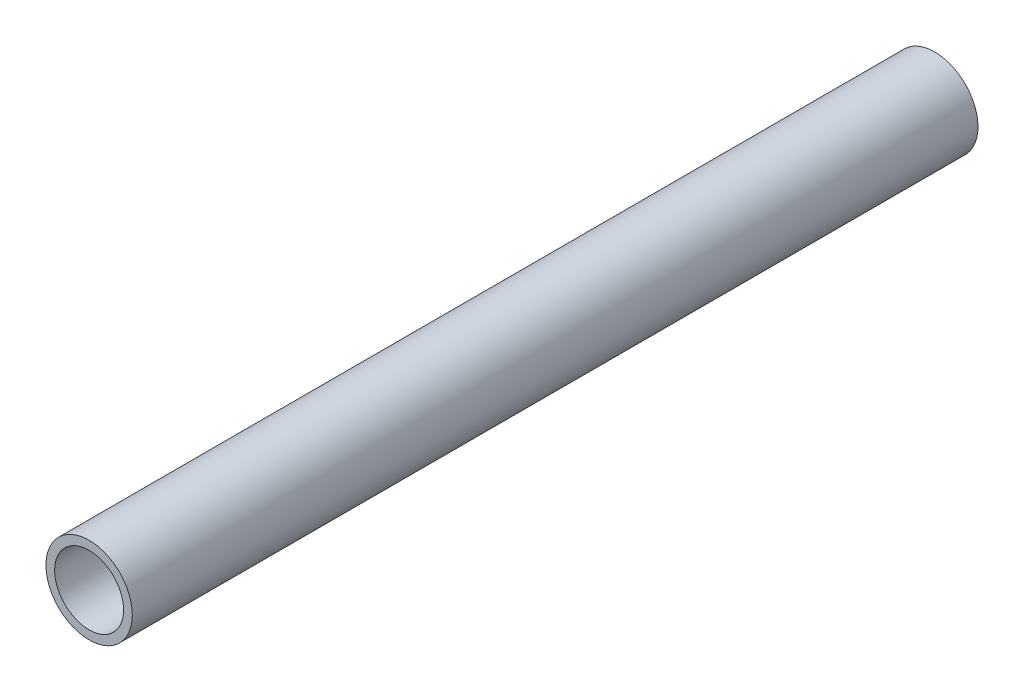
from build123d import *

# Parameters (mm, degrees)
SKETCH1_R           = 16.7005
SKETCH1_R_2         = 13.3223
BOSS_EXTRUDE1_DEPTH = 163.5


with BuildPart() as part:
    # Sketch1 → Boss-Extrude1 (new, symmetric)
    with BuildSketch(Plane.XY):
        Circle(SKETCH1_R)
        Circle(SKETCH1_R_2, mode=Mode.SUBTRACT)
    extrude(amount=BOSS_EXTRUDE1_DEPTH, both=True)


solid = part.part
